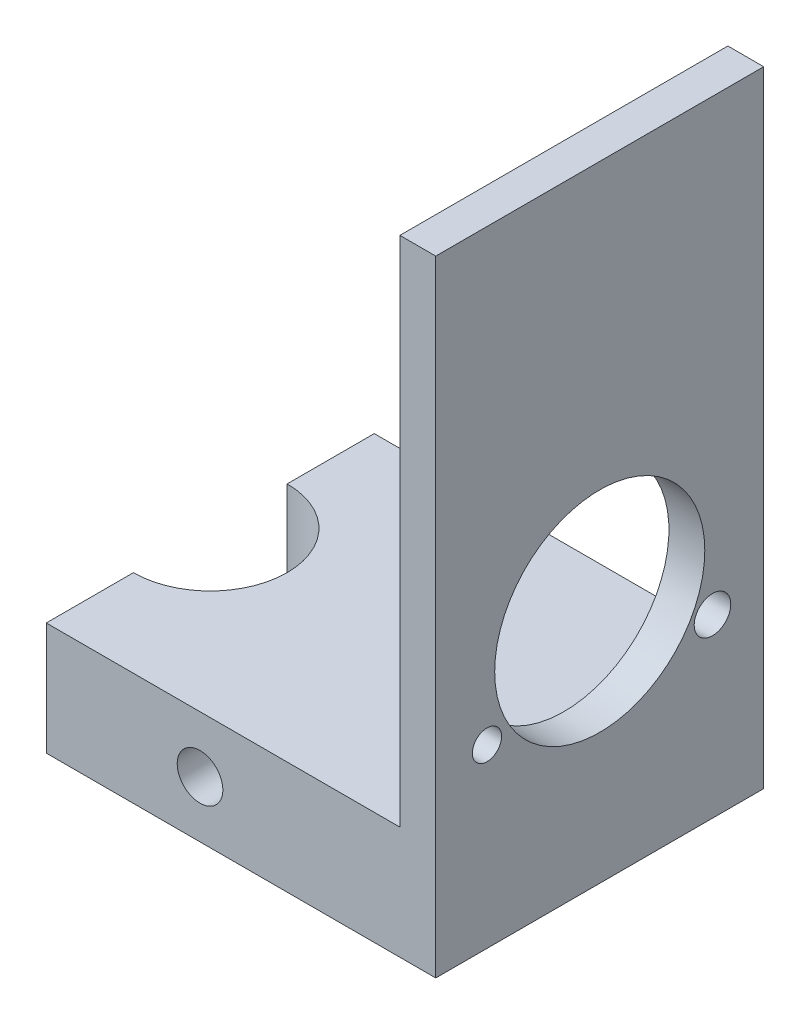
from build123d import *

# Parameters (mm, degrees)
BOSS_EXTRUDE1_DEPTH = 11
SKETCH2_W           = 3.5
SKETCH2_H           = 32
BOSS_EXTRUDE2_DEPTH = 50
SKETCH3_R           = 10.25
SKETCH3_R_2         = 1.783609491
SKETCH3_R_3         = 1.426196869
CUT_EXTRUDE1_DEPTH  = 50
SKETCH4_R           = 2.22645949
CUT_EXTRUDE2_DEPTH  = 36


with BuildPart() as part:
    # Sketch1 → Boss-Extrude1 (new body)
    with BuildSketch(Plane(origin=(0, 0, 0), x_dir=(1, 0, 0), z_dir=(0, 1, 0))):
        with BuildLine():
            Line((38, 16), (0, 16))
            Line((0, 16), (0, 7.5))
            ThreePointArc((0, 7.5), (5.303300859, 5.303300859), (7.5, 0))
            ThreePointArc((7.5, 0), (5.303300859, -5.303300859), (0, -7.5))
            Line((0, -7.5), (0, -16))
            Line((0, -16), (38, -16))
            Line((38, -16), (38, 16))
        make_face()
    extrude(amount=BOSS_EXTRUDE1_DEPTH)

    # Sketch2 → Boss-Extrude2 (add)
    with BuildSketch(Plane(origin=(0, 11, 0), x_dir=(1, 0, 0), z_dir=(0, 1, 0))):
        with Locations((36.25, 0)):
            Rectangle(SKETCH2_W, SKETCH2_H)
    extrude(amount=BOSS_EXTRUDE2_DEPTH)

    # Sketch3 → Cut-Extrude1 (cut)
    with BuildSketch(Plane.ZY.offset(-34.5)):
        with Locations((0, 23)):
            Circle(SKETCH3_R)
        with Locations((-11, 17.202811543)):
            Circle(SKETCH3_R_2)
        with Locations((11, 17.202811543)):
            Circle(SKETCH3_R_3)
    extrude(amount=-CUT_EXTRUDE1_DEPTH, mode=Mode.SUBTRACT)

    # Sketch4 → Cut-Extrude2 (cut)
    with BuildSketch(Plane(origin=(0, 0, -16), x_dir=(-1, 0, 0), z_dir=(0, 0, -1))):
        with Locations((-15, 5.5)):
            Circle(SKETCH4_R)
    extrude(amount=-CUT_EXTRUDE2_DEPTH, mode=Mode.SUBTRACT)


solid = part.part
